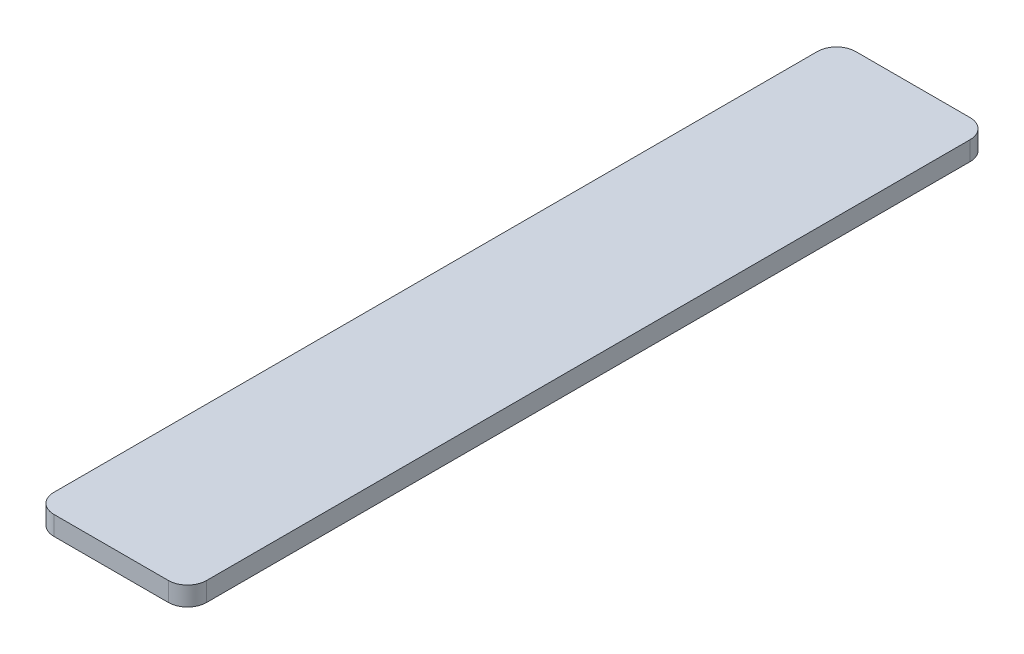
from build123d import *

# Parameters (mm, degrees)
BOSS_EXTRUDE1_DEPTH      = 66.675
BOSS_EXTRUDE1_DEPTH_BACK = 66.675
SKETCH3_W                = 25.4
SKETCH3_H                = 3.175
SKETCH4_OUTSIDE_W        = 54.556
SKETCH4_OUTSIDE_H        = 162.506
CUT_EXTRUDE1_DEPTH       = 68.947967225


with BuildPart() as part:
    # Sketch3 → Boss-Extrude1 (new, two sides: drawn at the far end of the back side and taken through both)
    with BuildSketch(Plane.XY.offset(-BOSS_EXTRUDE1_DEPTH_BACK)):
        Rectangle(SKETCH3_W, SKETCH3_H)
    extrude(amount=BOSS_EXTRUDE1_DEPTH + BOSS_EXTRUDE1_DEPTH_BACK)

    # Sketch4 outside → Cut-Extrude1 (cut, through all)
    with BuildSketch(Plane(origin=(0, 1.5875, 0), x_dir=(1, 0, 0), z_dir=(0, 1, 0))):
        Rectangle(SKETCH4_OUTSIDE_W, SKETCH4_OUTSIDE_H)
        with BuildLine():
            Line((12.7, -63.5), (12.7, 63.5))
            ThreePointArc((12.7, 63.5), (11.77006403, 65.74506403), (9.525, 66.675))
            Line((9.525, 66.675), (-9.525, 66.675))
            ThreePointArc((-9.525, 66.675), (-11.77006403, 65.74506403), (-12.7, 63.5))
            Line((-12.7, 63.5), (-12.7, -63.5))
            ThreePointArc((-12.7, -63.5), (-11.77006403, -65.74506403), (-9.525, -66.675))
            Line((-9.525, -66.675), (9.525, -66.675))
            ThreePointArc((9.525, -66.675), (11.77006403, -65.74506403), (12.7, -63.5))
        make_face(mode=Mode.SUBTRACT)
    extrude(amount=-CUT_EXTRUDE1_DEPTH, mode=Mode.SUBTRACT)


solid = part.part
